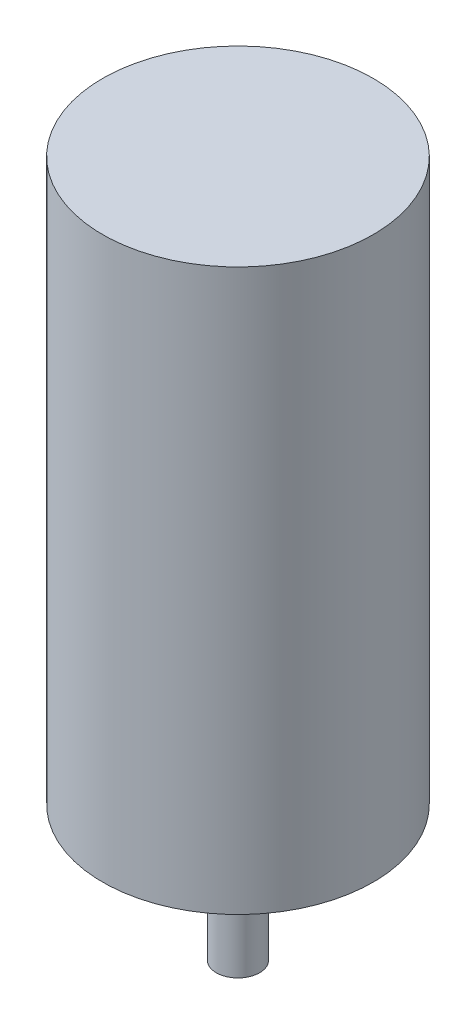
from build123d import *

# Parameters (mm, degrees)
SKETCH1_R           = 12.5
BOSS_EXTRUDE1_DEPTH = 51.8
SKETCH2_R           = 3.5
BOSS_EXTRUDE2_DEPTH = 2.5
SKETCH3_R           = 2
BOSS_EXTRUDE3_DEPTH = 10
SKETCH4_R           = 1.65
CUT_EXTRUDE1_DEPTH  = 5


with BuildPart() as part:
    # Sketch1 → Boss-Extrude1 (new body)
    with BuildSketch(Plane(origin=(0, 0, 0), x_dir=(1, 0, 0), z_dir=(0, 1, 0))):
        with Locations(Location((0, 0, 0), (0, 0, 90))):
            Circle(SKETCH1_R)
    extrude(amount=BOSS_EXTRUDE1_DEPTH)

    # Sketch2 → Boss-Extrude2 (add)
    with BuildSketch(Plane(origin=(0, 0, 0), x_dir=(-1, 0, 0), z_dir=(0, -1, 0))):
        with Locations(Location((0, 0, 0), (0, 0, 270))):
            Circle(SKETCH2_R)
    extrude(amount=BOSS_EXTRUDE2_DEPTH)

    # Sketch3 → Boss-Extrude3 (add)
    with BuildSketch(Plane(origin=(0, -2.5, 0), x_dir=(-1, 0, 0), z_dir=(0, -1, 0))):
        with Locations(Location((0, 0, 0), (0, 0, 90))):
            Circle(SKETCH3_R)
    extrude(amount=BOSS_EXTRUDE3_DEPTH)

    # Sketch4 → Cut-Extrude1 (cut)
    with BuildSketch(Plane(origin=(0, 0, 0), x_dir=(-1, 0, 0), z_dir=(0, -1, 0))):
        with Locations(Location((8.5, 0, 0), (0, 0, 90))):
            Circle(SKETCH4_R)
        with Locations(Location((-8.5, 0, 0), (0, 0, 90))):
            Circle(SKETCH4_R)
    extrude(amount=-CUT_EXTRUDE1_DEPTH, mode=Mode.SUBTRACT)


solid = part.part
